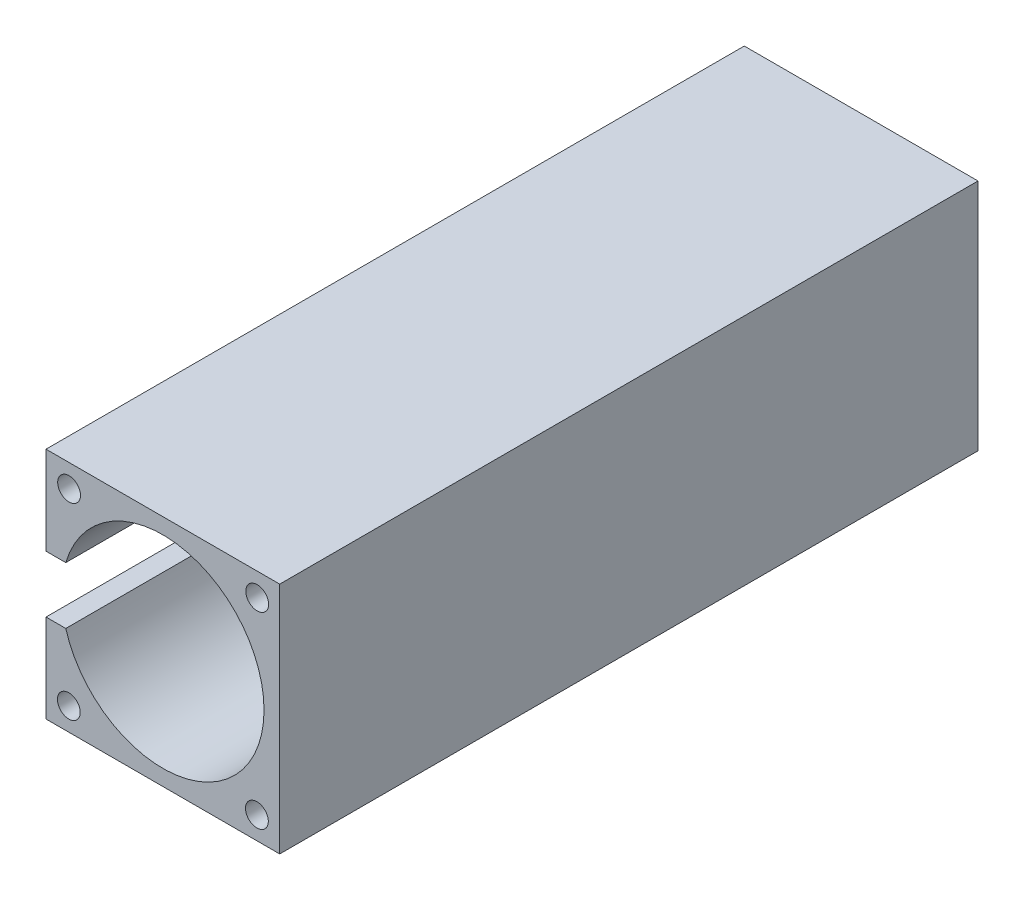
from build123d import *

# Parameters (mm, degrees)
SKETCH_1_W               = 82
SKETCH_1_H               = 82
SKETCH_1_R               = 35.5
EXTRUDE_1_DEPTH          = 245
SKETCH_2_W               = 82
SKETCH_2_H               = 82
EXTRUDE_2_DEPTH          = 27
SKETCH_3_W               = 8
SKETCH_3_H               = 20
CUT_EXTRUDE_1_DEPTH      = 245
SKETCH_4_R               = 4
CUT_EXTRUDE_2_DEPTH      = 20
FILLET_2_R               = 3
FILLET_3_R               = 3
FILLET_4_R               = 3
FILLET_5_R               = 3
SKETCH_5_R               = 1.05
CUT_EXTRUDE_3_DEPTH      = 10
EXTRUDE_START            = 0.2
SKETCH_6_R               = 1.05
EXTRUDE_3_DEPTH          = 0.2
CUT_EXTRUDE_5_REACH      = 263.591
SKETCH_7_W               = 20
SKETCH_7_H               = 65
CUT_EXTRUDE_6_REACH      = 263.591
SKETCH_8_W               = 41
SKETCH_8_H               = 20
SKETCH_9_R               = 1.2
CUT_EXTRUDE_7_DEPTH      = 12
CUT_EXTRUDE_8_DEPTH      = 262.591284258
CUT_EXTRUDE_8_DEPTH_BACK = 262.591284258
SKETCH_10_W              = 27
SKETCH_10_H              = 82


with BuildPart() as part:
    # 草圖1 → 填料-伸長1 (new body)
    with BuildSketch(Plane.XY):
        Rectangle(SKETCH_1_W, SKETCH_1_H)
        Circle(SKETCH_1_R, mode=Mode.SUBTRACT)
    extrude(amount=EXTRUDE_1_DEPTH)

    # 草圖2 → 填料-伸長2 (add)
    with BuildSketch(Plane(origin=(0, 0, 0), x_dir=(-1, 0, 0), z_dir=(0, 0, -1))):
        Rectangle(SKETCH_2_W, SKETCH_2_H)
    extrude(amount=EXTRUDE_2_DEPTH)

    # 草圖3 → 除料-伸長1 (cut)
    with BuildSketch(Plane.XY.offset(245)):
        with Locations((-37, 0)):
            Rectangle(SKETCH_3_W, SKETCH_3_H)
    extrude(amount=-CUT_EXTRUDE_1_DEPTH, mode=Mode.SUBTRACT)

    # 草圖4 → 除料-伸長2 (cut)
    with BuildSketch(Plane.XY.offset(245)):
        with Locations((-32.9, 33)):
            Circle(SKETCH_4_R)
        with Locations((33.1, 32.9)):
            Circle(SKETCH_4_R)
        with Locations((33, -33.1)):
            Circle(SKETCH_4_R)
        with Locations((-33, -33)):
            Circle(SKETCH_4_R)
    extrude(amount=-CUT_EXTRUDE_2_DEPTH, mode=Mode.SUBTRACT)

    # 圓角2
    fillet_2_edges = [part.edges().sort_by_distance(p)[0] for p in [
        (-36.9, 33, 225),
    ]]
    fillet(fillet_2_edges, radius=FILLET_2_R)

    # 圓角3
    fillet_3_edges = [part.edges().sort_by_distance(p)[0] for p in [
        (29.1, 32.9, 225),
    ]]
    fillet(fillet_3_edges, radius=FILLET_3_R)

    # 圓角4
    fillet_4_edges = [part.edges().sort_by_distance(p)[0] for p in [
        (-37, -33, 225),
    ]]
    fillet(fillet_4_edges, radius=FILLET_4_R)

    # 圓角5
    fillet_5_edges = [part.edges().sort_by_distance(p)[0] for p in [
        (29, -33.1, 225),
    ]]
    fillet(fillet_5_edges, radius=FILLET_5_R)

    # 草圖5 → 除料-伸長3 (cut)
    with BuildSketch(Plane(origin=(0, 41, 0), x_dir=(1, 0, 0), z_dir=(0, 1, 0))):
        with Locations(Location((-36.75, 22.75, 0), (0, 0, 270))):
            Circle(SKETCH_5_R)
        with Locations(Location((-36.75, 4.75, 0), (0, 0, 270))):
            Circle(SKETCH_5_R)
    extrude(amount=-CUT_EXTRUDE_3_DEPTH, mode=Mode.SUBTRACT)

    # 草圖6 → 填料-伸長3 (add)
    with BuildSketch(Plane(origin=(0, 35, 0), x_dir=(1, 0, 0), z_dir=(0, 1, 0)).offset(EXTRUDE_START)):
        with Locations(Location((-36.75, 22.75, 0), (0, 0, 270))):
            Circle(SKETCH_6_R)
        with Locations(Location((-36.75, 4.75, 0), (0, 0, 270))):
            Circle(SKETCH_6_R)
    extrude(amount=-EXTRUDE_3_DEPTH)

    # 草圖7 → 除料-伸長5 (cut, up to next)
    with BuildSketch(Plane(origin=(-41, 0, 0), x_dir=(0, 0, -1), z_dir=(1, 0, 0)), mode=Mode.PRIVATE) as cut_extrude_5_sk1:
        with Locations((17, -8.5)):
            Rectangle(SKETCH_7_W, SKETCH_7_H)
    cut_extrude_5_tool1 = extrude(cut_extrude_5_sk1.sketch, amount=CUT_EXTRUDE_5_REACH, mode=Mode.PRIVATE) & part.part
    add(cut_extrude_5_tool1.solids().sort_by_distance((-41, -8.5, -17))[0], mode=Mode.SUBTRACT)

    # 草圖8 → 除料-伸長6 (cut, up to next)
    with BuildSketch(Plane(origin=(0, 41, 0), x_dir=(1, 0, 0), z_dir=(0, 1, 0)), mode=Mode.PRIVATE) as cut_extrude_6_sk1:
        with Locations((20.5, 17)):
            Rectangle(SKETCH_8_W, SKETCH_8_H)
    cut_extrude_6_tool1 = extrude(cut_extrude_6_sk1.sketch, amount=-CUT_EXTRUDE_6_REACH, mode=Mode.PRIVATE) & part.part
    add(cut_extrude_6_tool1.solids().sort_by_distance((20.5, 41, -17))[0], mode=Mode.SUBTRACT)

    # 草圖9 → 除料-伸長7 (cut)
    with BuildSketch(Plane(origin=(0, 0, -7), x_dir=(-1, 0, 0), z_dir=(0, 0, -1))):
        with Locations((-33, 33)):
            Circle(SKETCH_9_R)
        with Locations((-33, -33)):
            Circle(SKETCH_9_R)
        with Locations((33, -33)):
            Circle(SKETCH_9_R)
        with Locations((36, 20)):
            Circle(SKETCH_9_R)
    extrude(amount=-CUT_EXTRUDE_7_DEPTH, mode=Mode.SUBTRACT)

    # 草圖10 → 除料-伸長8 (cut, two sides: drawn at the far end of the back side and taken through both)
    with BuildSketch(Plane.ZY.offset(41).offset(-CUT_EXTRUDE_8_DEPTH_BACK)):
        with Locations((-13.5, 0)):
            Rectangle(SKETCH_10_W, SKETCH_10_H)
    extrude(amount=CUT_EXTRUDE_8_DEPTH + CUT_EXTRUDE_8_DEPTH_BACK, mode=Mode.SUBTRACT)


solid = part.part
